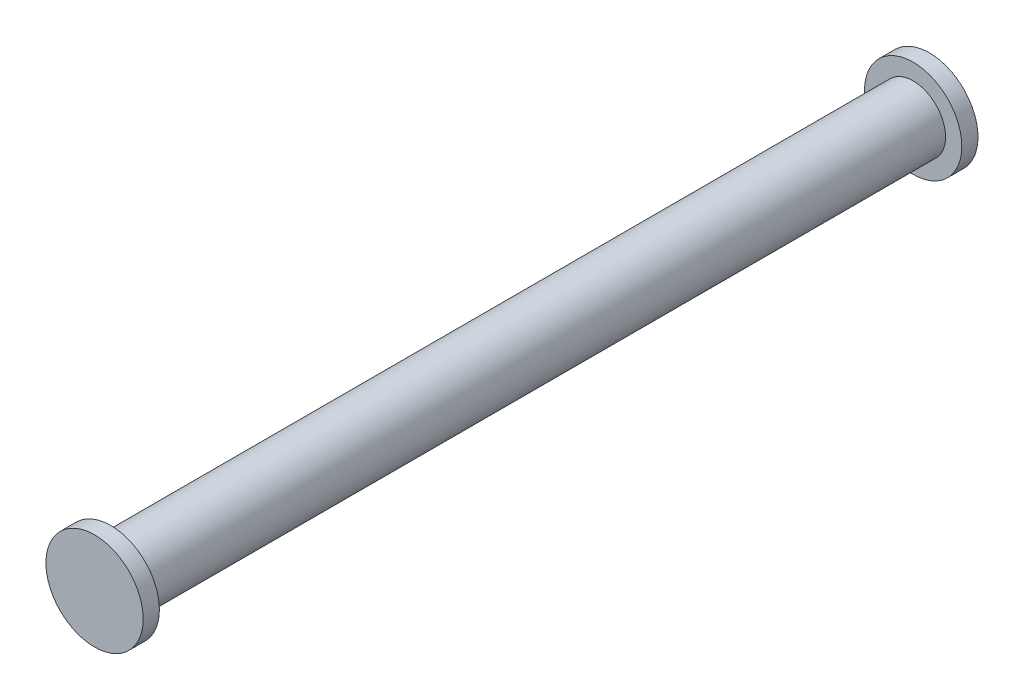
from build123d import *

# Parameters (mm, degrees)
SKETCH_1_R      = 6
EXTRUDE_1_DEPTH = 2
SKETCH_2_R      = 4
EXTRUDE_2_DEPTH = 99
SKETCH_3_R      = 6
EXTRUDE_3_DEPTH = 2


with BuildPart() as part:
    # 草图1 → 凸台-拉伸1 (new body)
    with BuildSketch(Plane.XY):
        Circle(SKETCH_1_R)
    extrude(amount=EXTRUDE_1_DEPTH)

    # 草图2 → 凸台-拉伸2 (add)
    with BuildSketch(Plane.XY.offset(2)):
        Circle(SKETCH_2_R)
    extrude(amount=EXTRUDE_2_DEPTH)

    # 草图3 → 凸台-拉伸3 (add)
    with BuildSketch(Plane.XY.offset(101)):
        Circle(SKETCH_3_R)
    extrude(amount=EXTRUDE_3_DEPTH)


solid = part.part
